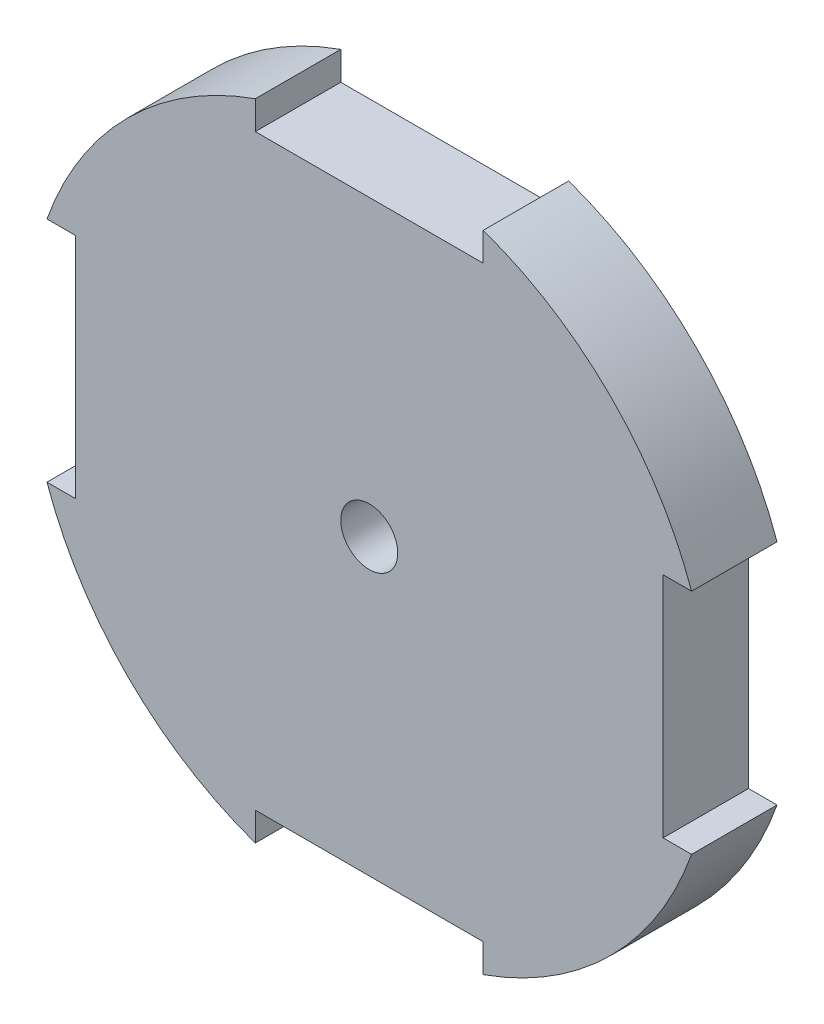
from build123d import *

# Parameters (mm, degrees)
BOSS_EXTRUDE2_DEPTH = 9.525
SKETCH3_R           = 6.35
CUT_EXTRUDE2_DEPTH  = 19.05


with BuildPart() as part:
    # Sketch1 → Boss-Extrude2 (new, symmetric)
    with BuildSketch(Plane.XY):
        with BuildLine():
            Line((-25.4, 71.842048969), (-25.4, 65.492048969))
            Line((-25.4, 65.492048969), (25.4, 65.492048969))
            Line((25.4, 65.492048969), (25.4, 71.842048969))
            ThreePointArc((25.4, 71.842048969), (53.881536726, 53.881536726), (71.842048969, 25.4))
            Line((71.842048969, 25.4), (65.492048969, 25.4))
            Line((65.492048969, 25.4), (65.492048969, -25.4))
            Line((65.492048969, -25.4), (71.842048969, -25.4))
            ThreePointArc((71.842048969, -25.4), (53.881536726, -53.881536726), (25.4, -71.842048969))
            Line((25.4, -71.842048969), (25.4, -65.492048969))
            Line((25.4, -65.492048969), (-25.4, -65.492048969))
            Line((-25.4, -65.492048969), (-25.4, -71.842048969))
            ThreePointArc((-25.4, -71.842048969), (-53.881536726, -53.881536726), (-71.842048969, -25.4))
            Line((-71.842048969, -25.4), (-65.492048969, -25.4))
            Line((-65.492048969, -25.4), (-65.492048969, 25.4))
            Line((-65.492048969, 25.4), (-71.842048969, 25.4))
            ThreePointArc((-71.842048969, 25.4), (-53.881536726, 53.881536726), (-25.4, 71.842048969))
        make_face()
    extrude(amount=BOSS_EXTRUDE2_DEPTH, both=True)

    # Sketch3 → Cut-Extrude2 (cut)
    with BuildSketch(Plane.XY.offset(9.525)):
        Circle(SKETCH3_R)
    extrude(amount=-CUT_EXTRUDE2_DEPTH, mode=Mode.SUBTRACT)


solid = part.part
